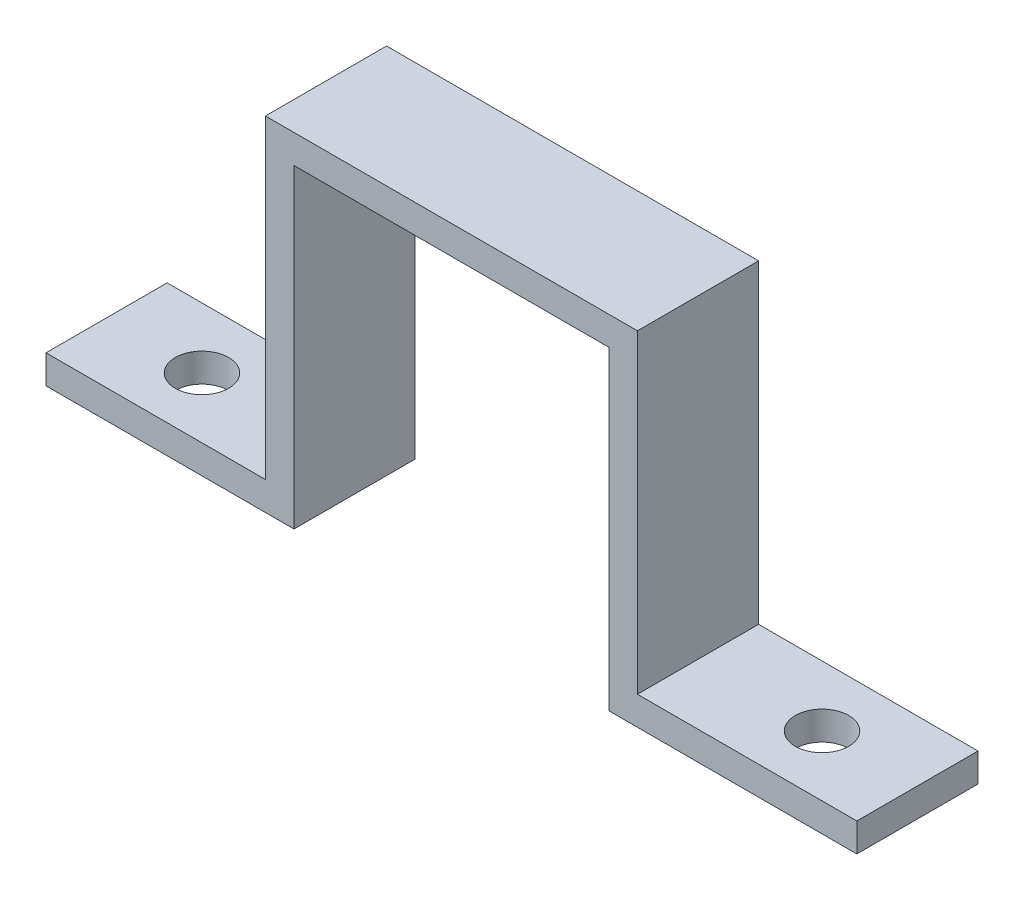
from build123d import *

# Parameters (mm, degrees)
EXTRUDE_THIN1_DEPTH      = 6.35
EXTRUDE_THIN1_DEPTH_BACK = 6.35
CUT_EXTRUDE2_DEPTH       = 57.058652321
CUT_EXTRUDE2_DEPTH_BACK  = 57.058652321
SKETCH2_R                = 2.8


with BuildPart() as part:
    # Sketch1 → Extrude-Thin1 (new, two sides: drawn at the far end of the back side and taken through both)
    with BuildSketch(Plane.XY.offset(-EXTRUDE_THIN1_DEPTH_BACK)):
        Polygon((-42.5, 0), (-16.5, 0), (-16.5, 33), (16.5, 33), (16.5, 0), (42.5, 0), (42.5, 3), (19.5, 3), (19.5, 36), (-19.5, 36), (-19.5, 3), (-42.5, 3), align=None)
    extrude(amount=EXTRUDE_THIN1_DEPTH + EXTRUDE_THIN1_DEPTH_BACK)

    # Sketch2 → Cut-Extrude2 (cut, two sides: drawn at the far end of the back side and taken through both)
    with BuildSketch(Plane(origin=(0, 0, 0), x_dir=(1, 0, 0), z_dir=(0, 1, 0)).offset(-CUT_EXTRUDE2_DEPTH_BACK)):
        with Locations(Location((32.5, 0, 0), (0, 0, 270))):
            Circle(SKETCH2_R)
        with Locations(Location((-32.5, 0, 0), (0, 0, 270))):
            Circle(SKETCH2_R)
    extrude(amount=CUT_EXTRUDE2_DEPTH + CUT_EXTRUDE2_DEPTH_BACK, mode=Mode.SUBTRACT)


solid = part.part
